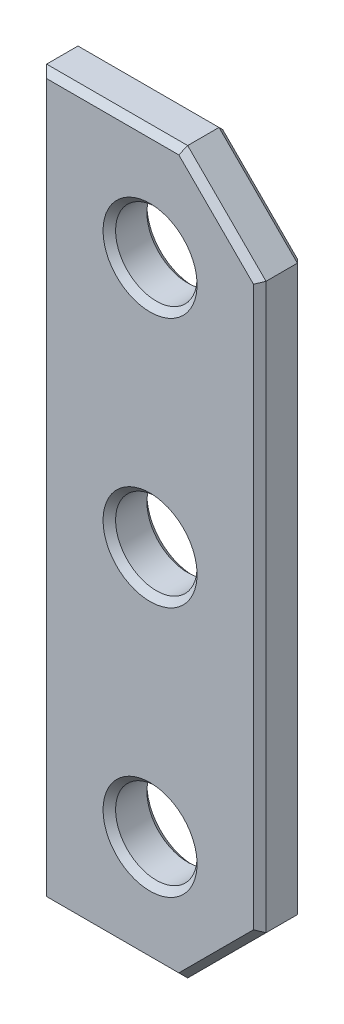
from build123d import *

# Parameters (mm, degrees)
SKETCH_1_R        = 13
EXTRUDE_456_DEPTH = 14
CHAMFER_1_SIZE    = 2


with BuildPart() as part:
    # 草图1 → Extrude 456 (new body)
    with BuildSketch(Plane.XY):
        Polygon((0, 0), (45, 0), (70, 25), (70, 205), (45, 230), (0, 230), align=None)
        with Locations((35, 35)):
            Circle(SKETCH_1_R, mode=Mode.SUBTRACT)
        with Locations((35, 115)):
            Circle(SKETCH_1_R, mode=Mode.SUBTRACT)
        with Locations((35, 195)):
            Circle(SKETCH_1_R, mode=Mode.SUBTRACT)
    extrude(amount=EXTRUDE_456_DEPTH)

    # 倒角1
    chamfer_1_edges = [part.edges().sort_by_distance(p)[0] for p in [
        (57.5, 12.5, 14),
        (70, 115, 14),
        (57.5, 217.5, 14),
        (22, 35, 0),
        (22, 35, 14),
        (22.5, 230, 14),
        (22, 115, 0),
        (22, 115, 14),
        (22, 195, 0),
        (22, 195, 14),
        (0, 115, 14),
        (22.5, 230, 0),
        (57.5, 217.5, 0),
        (70, 115, 0),
        (22.5, 0, 14),
        (57.5, 12.5, 0),
        (22.5, 0, 0),
        (0, 115, 0),
    ]]
    chamfer(chamfer_1_edges, length=CHAMFER_1_SIZE)


solid = part.part
